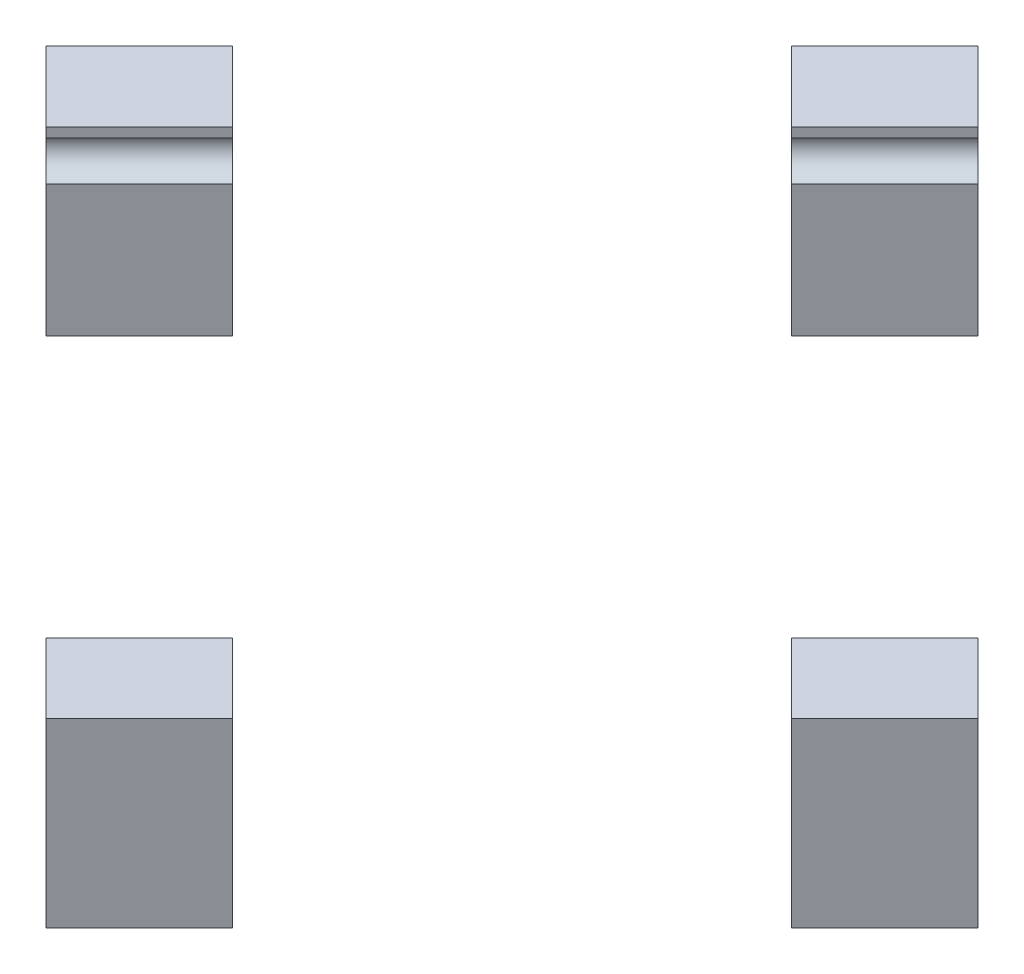
from build123d import *

# Parameters (mm, degrees)
BOSS_EXTRUDE3_DEPTH     = 5.5
BOSS_EXTRUDE3_2_DEPTH   = 5.5
BOSS_EXTRUDE3_3_DEPTH   = 5.5
BOSS_EXTRUDE3_4_DEPTH   = 5.5
CUT_EXTRUDE2_DEPTH      = 34.017772808
CUT_EXTRUDE2_DEPTH_BACK = 34.017772808
CUT_EXTRUDE5_DEPTH      = 34.017772808


with BuildPart() as part:
    # Sketch5 → Boss-Extrude3 (new body)
    with BuildSketch(Plane(origin=(0, 0, 0), x_dir=(1, 0, 0), z_dir=(0, 1, 0))):
        Polygon((9.584998142, -5.382202346), (12.413425266, -2.553775221), (10.292104923, -0.432454878), (7.463677798, -3.260882003), align=None)
    extrude(amount=BOSS_EXTRUDE3_DEPTH)


with BuildPart() as body_2:
    # Sketch5 → Boss-Extrude3 2 (new body)
    with BuildSketch(Plane(origin=(0, 0, 0), x_dir=(1, 0, 0), z_dir=(0, 1, 0))):
        Polygon((-5.971351044, 10.17414684), (-3.14292392, 13.002573965), (-5.264244263, 15.123894308), (-8.092671388, 12.295467184), align=None)
    extrude(amount=BOSS_EXTRUDE3_2_DEPTH)


with BuildPart() as body_3:
    # Sketch5 → Boss-Extrude3 3 (new body)
    with BuildSketch(Plane(origin=(0, 0, 0), x_dir=(1, 0, 0), z_dir=(0, 1, 0))):
        Polygon((-17.285059543, -1.139561659), (-14.456632419, 1.688865466), (-16.577952762, 3.810185809), (-19.406379887, 0.981758685), align=None)
    extrude(amount=BOSS_EXTRUDE3_3_DEPTH)


with BuildPart() as body_4:
    # Sketch5 → Boss-Extrude3 4 (new body)
    with BuildSketch(Plane(origin=(0, 0, 0), x_dir=(1, 0, 0), z_dir=(0, 1, 0))):
        Polygon((-1.728710357, -16.695910845), (1.099716767, -13.86748372), (-1.021603576, -11.746163377), (-3.850030701, -14.574590502), align=None)
    extrude(amount=BOSS_EXTRUDE3_4_DEPTH)


with BuildPart() as cut_extrude2_tool:
    # Sketch6 → Cut-Extrude2 (new, two sides: drawn at the far end of the back side and taken through both)
    with BuildSketch(Plane(origin=(4.929825023, 0, -4.929825023), x_dir=(-0.7071067811865475, 0, -0.7071067811865477), z_dir=(0.7071067811865477, 0, -0.7071067811865475)).offset(-CUT_EXTRUDE2_DEPTH_BACK)):
        with BuildLine():
            Line((67.256085177, 5.2), (-7.58340896, 5.2))
            ThreePointArc((-7.58340896, 5.2), (-8.18340896, 4.6), (-7.58340896, 4))
            Line((-7.58340896, 4), (67.256085177, 4))
            Line((67.256085177, 4), (216.935073452, 4))
            Line((216.935073452, 4), (216.935073452, 5.2))
            Line((216.935073452, 5.2), (67.256085177, 5.2))
        make_face()
    extrude(amount=CUT_EXTRUDE2_DEPTH + CUT_EXTRUDE2_DEPTH_BACK)


with BuildPart() as body_4_1:
    add(body_4.part)

    # Cut-Extrude2: cut by cut_extrude2_tool
    add(cut_extrude2_tool.part, mode=Mode.SUBTRACT)


with BuildPart() as part_1:
    add(part.part)

    # Cut-Extrude2: cut by cut_extrude2_tool
    add(cut_extrude2_tool.part, mode=Mode.SUBTRACT)


with BuildPart() as cut_extrude5_tool:
    # Sketch7 → Cut-Extrude5 (new, through all)
    with BuildSketch(Plane(origin=(4.929825023, 0, -4.929825023), x_dir=(-0.7071067811865479, 0, -0.7071067811865472), z_dir=(0.7071067811865472, 0, -0.7071067811865479))):
        with BuildLine():
            Line((11.41659104, 5.2), (11.41659104, 4))
            ThreePointArc((11.41659104, 4), (12.01659104, 4.6), (11.41659104, 5.2))
        make_face()
    extrude(amount=-CUT_EXTRUDE5_DEPTH)


with BuildPart() as body_2_1:
    add(body_2.part)

    # Cut-Extrude5: cut by cut_extrude5_tool
    add(cut_extrude5_tool.part, mode=Mode.SUBTRACT)


with BuildPart() as body_3_1:
    add(body_3.part)

    # Cut-Extrude5: cut by cut_extrude5_tool
    add(cut_extrude5_tool.part, mode=Mode.SUBTRACT)


solid = Compound([body_4_1.part, part_1.part, body_2_1.part, body_3_1.part])
